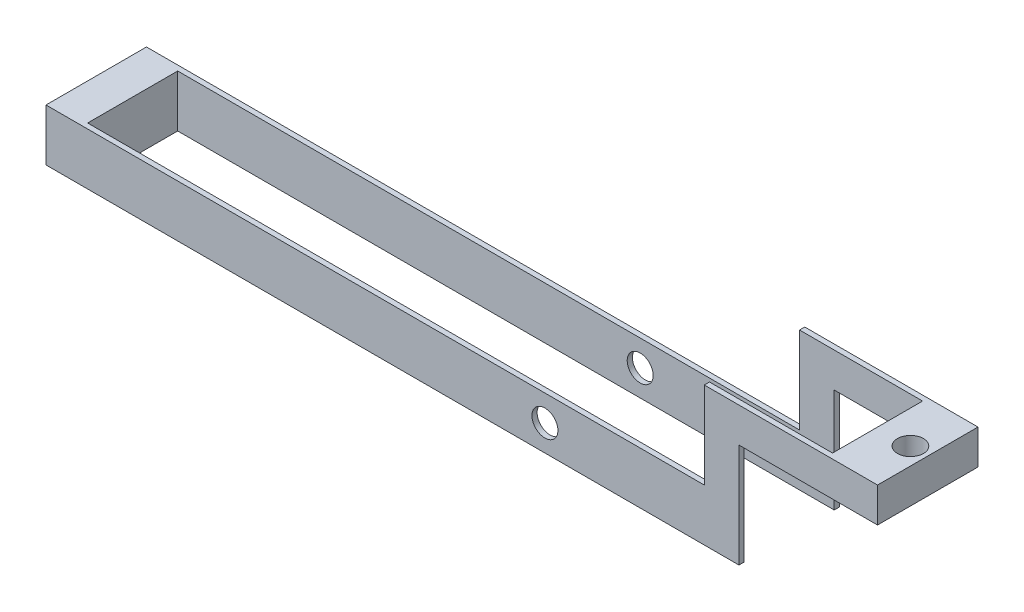
from build123d import *

# Parameters (mm, degrees)
SKETCH1_R           = 4.7625
BOSS_EXTRUDE1_DEPTH = 36.83
SKETCH2_W           = 273.05
SKETCH2_H           = 33.02
CUT_EXTRUDE1_DEPTH  = 312.191466625
SKETCH4_R           = 4.7625
CUT_EXTRUDE3_DEPTH  = 312.191466625


with BuildPart() as part:
    # Sketch1 → Boss-Extrude1 (new body)
    with BuildSketch(Plane.XY):
        Polygon((304.8, 50.8), (304.8, 38.1), (254, 38.1), (254, 0), (0, 0), (0, 19.05), (241.3, 19.05), (241.3, 50.8), align=None)
        with Locations((182.88, 9.525)):
            Circle(SKETCH1_R, mode=Mode.SUBTRACT)
    extrude(amount=BOSS_EXTRUDE1_DEPTH)

    # Sketch2 → Cut-Extrude1 (cut, through all)
    with BuildSketch(Plane.XZ):
        with Locations((149.876052358, 18.415)):
            Rectangle(SKETCH2_W, SKETCH2_H)
    extrude(amount=-CUT_EXTRUDE1_DEPTH, mode=Mode.SUBTRACT)

    # Sketch4 → Cut-Extrude3 (cut, through all)
    with BuildSketch(Plane(origin=(0, 50.8, 0), x_dir=(1, 0, 0), z_dir=(0, 1, 0))):
        with Locations(Location((298.45, -18.415, 0), (0, 0, 270))):
            Circle(SKETCH4_R)
    extrude(amount=-CUT_EXTRUDE3_DEPTH, mode=Mode.SUBTRACT)


solid = part.part
